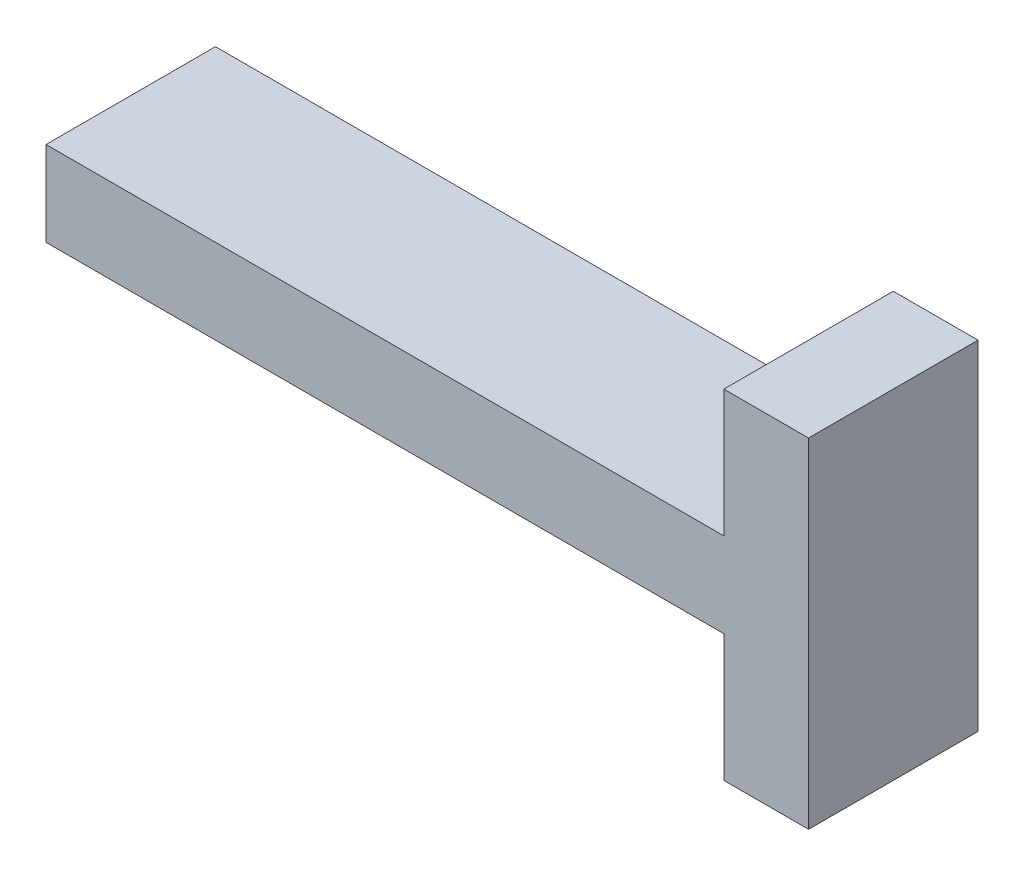
from build123d import *

# Parameters (mm, degrees)
BOSS_EXTRUDE2_DEPTH = 20


with BuildPart() as part:
    # Sketch3 → Boss-Extrude2 (new body)
    with BuildSketch(Plane.XY):
        Polygon((-61.589242054, 33.288508557), (-61.589242054, -6.711491443), (-71.589242054, -6.711491443), (-71.589242054, 8.288508557), (-151.589242054, 8.288508557), (-151.589242054, 18.288508557), (-71.589242054, 18.288508557), (-71.589242054, 33.288508557), align=None)
    extrude(amount=BOSS_EXTRUDE2_DEPTH)


solid = part.part
